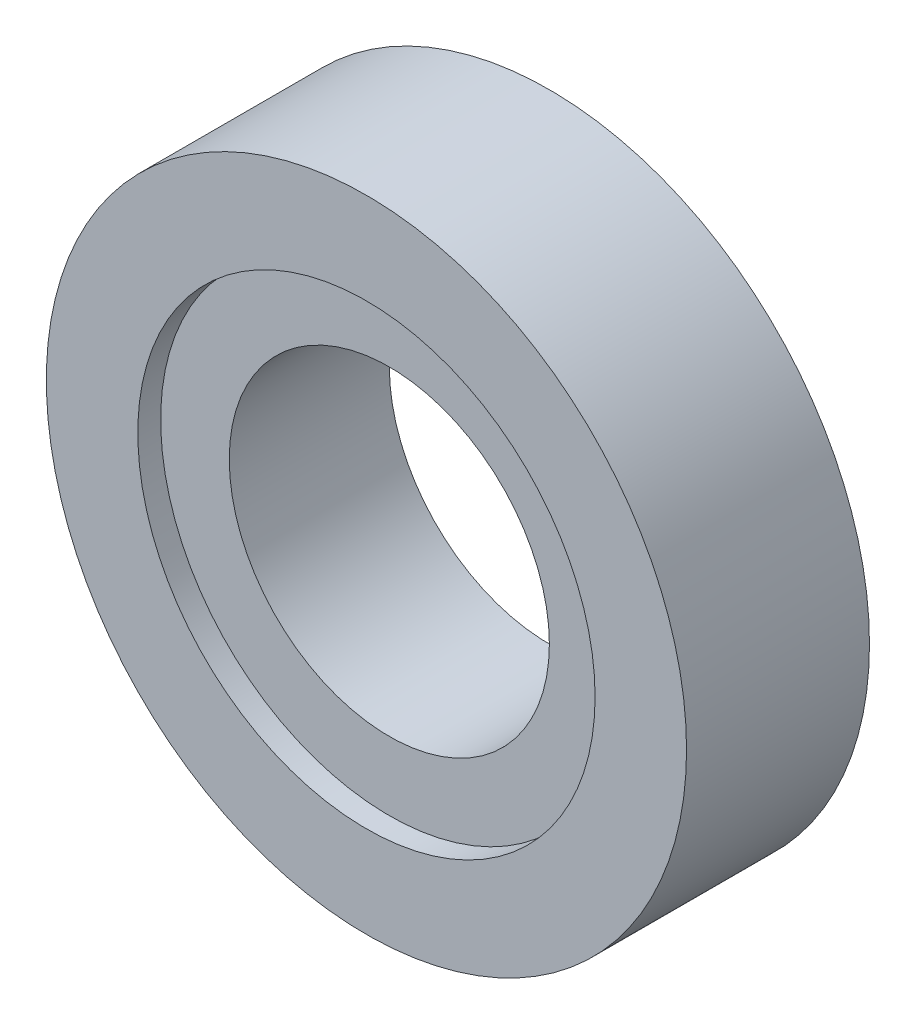
from build123d import *

# Parameters (mm, degrees)
SKETCH1_R           = 7
SKETCH1_R_2         = 3.5
BOSS_EXTRUDE1_DEPTH = 4
CUT_EXTRUDE1_START  = -0.5
SKETCH2_R           = 5
SKETCH2_R_2         = 3.5
CUT_EXTRUDE1_DEPTH  = 0.5


with BuildPart() as part:
    # Sketch1 → Boss-Extrude1 (new body)
    with BuildSketch(Plane.XY):
        Circle(SKETCH1_R)
        Circle(SKETCH1_R_2, mode=Mode.SUBTRACT)
    extrude(amount=BOSS_EXTRUDE1_DEPTH)

    # Sketch2 → Cut-Extrude1 (cut)
    with BuildSketch(Plane.XY.offset(4).offset(CUT_EXTRUDE1_START)):
        Circle(SKETCH2_R)
        Circle(SKETCH2_R_2, mode=Mode.SUBTRACT)
    extrude(amount=CUT_EXTRUDE1_DEPTH, mode=Mode.SUBTRACT)


solid = part.part
